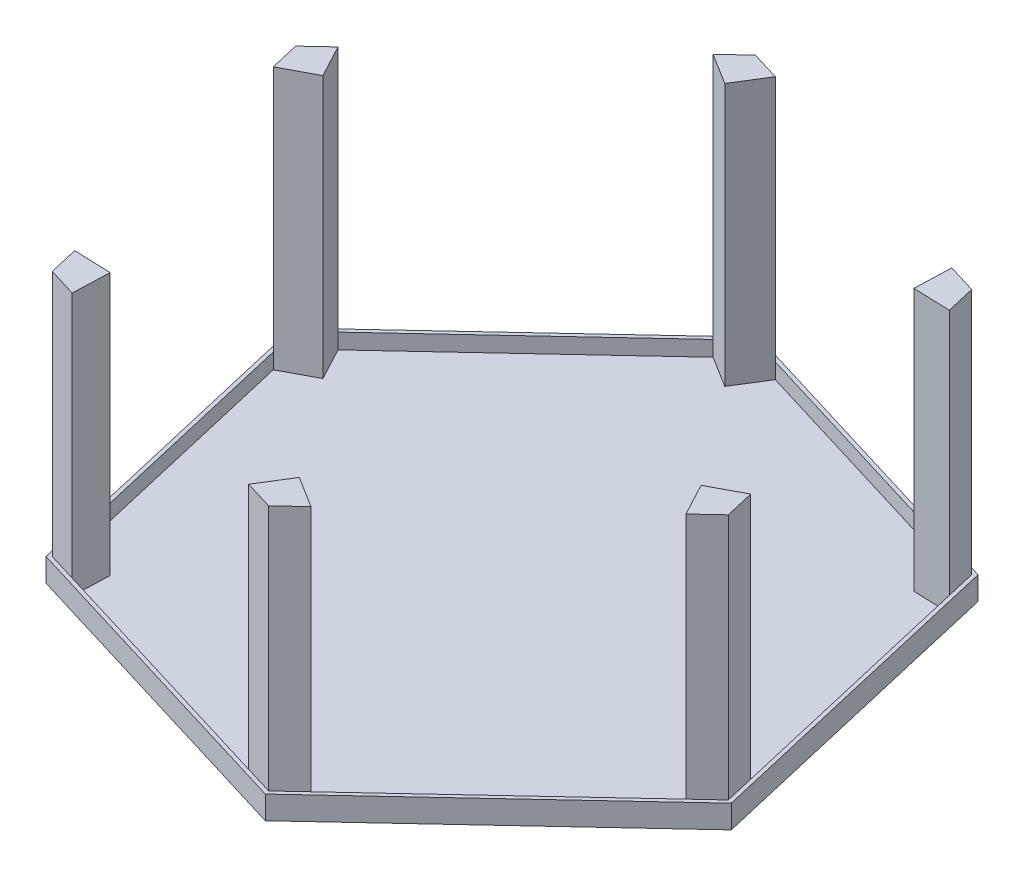
from build123d import *

# Parameters (mm, degrees)
BOSS_EXTRU_1_DEPTH            = 30
ENL_V_MAT_EXTRU_1_DEPTH       = 20
BOSS_EXTRU_3_DEPTH            = 340
ENL_V_MAT_EXTRU_2_DEPTH       = 710.357976131
ENL_V_START                   = -320
ENL_V_MAT_EXTRU_5_DEPTH       = 364
R_P_TITION_CIRCULAIRE13_COUNT = 6


with BuildPart() as part:
    # Esquisse1 → Boss.-Extru.1 (new body)
    with BuildSketch(Plane(origin=(0, 0, 0), x_dir=(1, 0, 0), z_dir=(0, 1, 0))):
        Polygon((312.198829019, 291.659432373), (-96.485063179, 416.201833149), (-408.683892198, 124.542400776), (-312.198829019, -291.659432373), (96.485063179, -416.201833149), (408.683892198, -124.542400776), align=None)
    extrude(amount=BOSS_EXTRU_1_DEPTH)

    # Esquisse2 → Enlèv. mat.-Extru.1 (cut)
    with BuildSketch(Plane(origin=(0, 30, 0), x_dir=(1, 0, 0), z_dir=(0, 1, 0))):
        Polygon((403.161136898, -122.85939536), (307.979925924, 287.718088693), (-95.181210974, 410.577484053), (-403.161136898, 122.85939536), (-307.979925924, -287.718088693), (95.181210974, -410.577484053), align=None)
    extrude(amount=-ENL_V_MAT_EXTRU_1_DEPTH, mode=Mode.SUBTRACT)

    # Esquisse5 → Boss.-Extru.3 (add)
    with BuildSketch(Plane(origin=(0, 10, 0), x_dir=(1, 0, 0), z_dir=(0, 1, 0))):
        Polygon((83.204563714, -358.91453872), (43.518265641, -422.554131312), (107.157858233, -462.240429385), (146.844156306, -398.600836793), align=None)
    boss_extru_3 = extrude(amount=BOSS_EXTRU_3_DEPTH)

    # Esquisse6 → Enlèv. mat.-Extru.2 (cut, through all)
    with BuildSketch(Plane(origin=(0, 350, 0), x_dir=(1, 0, 0), z_dir=(0, 1, 0))):
        Polygon((55.305373646, -403.65272736), (96.485063179, -416.201833149), (127.942752354, -386.813728788), (146.844156306, -398.600836793), (107.157858233, -462.240429385), (43.518265641, -422.554131312), align=None)
    enl_v_mat_extru_2 = extrude(amount=-ENL_V_MAT_EXTRU_2_DEPTH, mode=Mode.SUBTRACT)

    # Esquisse7 → Enlèv. mat.-Extru.5 (cut)
    with BuildSketch(Plane(origin=(0, 350, 0), x_dir=(1, 0, 0), z_dir=(0, 1, 0)).offset(ENL_V_START)):
        Polygon((58.044458918, -399.260423737), (55.305373646, -403.65272736), (96.485063179, -416.201833149), (127.942752354, -386.813728788), (123.550448731, -384.074643516), (95.181210974, -410.577484053), align=None)
    enl_v_mat_extru_5 = extrude(amount=ENL_V_MAT_EXTRU_5_DEPTH, mode=Mode.SUBTRACT)

    # Répétition circulaire13: Boss.-Extru.3, Enlèv. mat.-Extru.2, Enlèv. mat.-Extru.5 ×6 about axis
    r_p_tition_circulaire13_axis = Axis((0, 0, 0), (0, 1, 0))
    add([boss_extru_3.rotate(r_p_tition_circulaire13_axis, i * 360 / R_P_TITION_CIRCULAIRE13_COUNT) for i in range(1, R_P_TITION_CIRCULAIRE13_COUNT)])
    add([enl_v_mat_extru_2.rotate(r_p_tition_circulaire13_axis, i * 360 / R_P_TITION_CIRCULAIRE13_COUNT) for i in range(1, R_P_TITION_CIRCULAIRE13_COUNT)], mode=Mode.SUBTRACT)
    add([enl_v_mat_extru_5.rotate(r_p_tition_circulaire13_axis, i * 360 / R_P_TITION_CIRCULAIRE13_COUNT) for i in range(1, R_P_TITION_CIRCULAIRE13_COUNT)], mode=Mode.SUBTRACT)


solid = part.part
